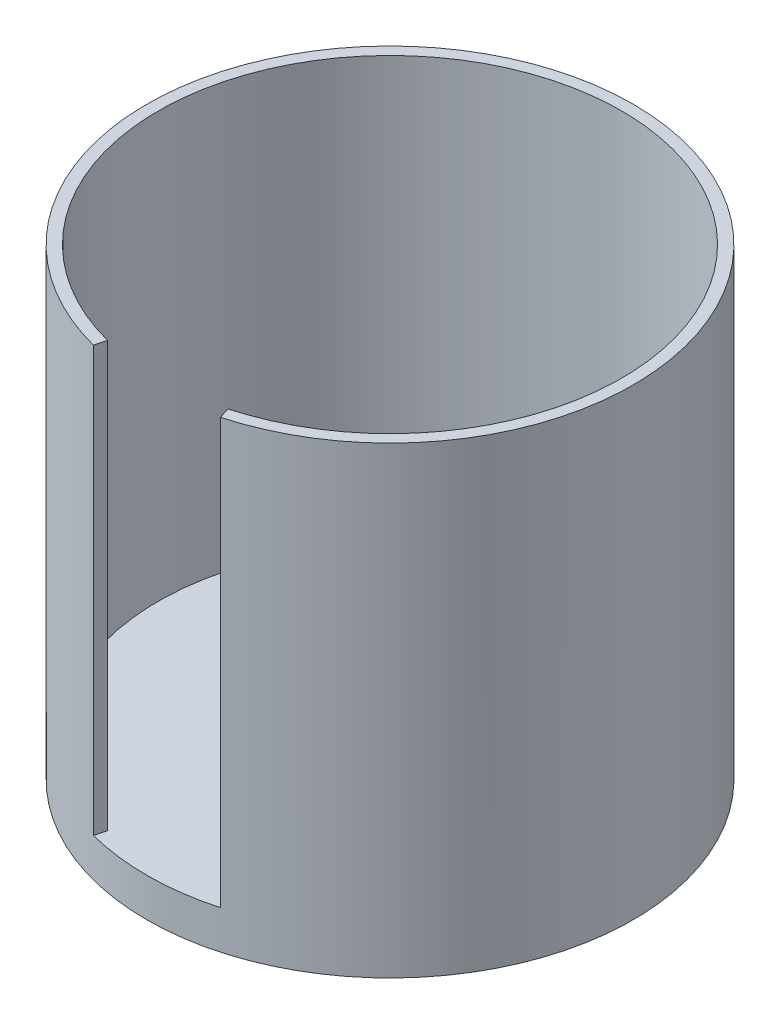
from build123d import *

# Parameters (mm, degrees)
ESQUISSE1_W             = 31.5
ESQUISSE1_H             = 60
ENL_V_START             = -55
ESQUISSE2_R             = 30
ENL_V_MAT_EXTRU_4_DEPTH = 55
ENL_V_MAT_EXTRU_7_DEPTH = 4


with BuildPart() as part:
    # Esquisse1 → Révolution1 (revolve)
    with BuildSketch(Plane.XY, mode=Mode.PRIVATE) as r_volution1_sk:
        with Locations((15.75, 30)):
            Rectangle(ESQUISSE1_W, ESQUISSE1_H)
    revolve(r_volution1_sk.sketch.rotate(Axis((0, 0, 0), (0, 1, 0)), 90), axis=Axis((0, 0, 0), (0, 1, 0)))

    # Esquisse2 → Enlèv. mat.-Extru.4 (cut)
    with BuildSketch(Plane(origin=(0, 60, 0), x_dir=(1, 0, 0), z_dir=(0, 1, 0)).offset(ENL_V_START)):
        Circle(ESQUISSE2_R)
        with BuildLine():
            Line((-7.923821592, -30.487096473), (0, 0))
            Line((0, 0), (8.381317443, -30.36451083))
            ThreePointArc((8.381317443, -30.36451083), (0.236817278, -31.49910979), (-7.923821592, -30.487096473))
        make_face()
    extrude(amount=ENL_V_MAT_EXTRU_4_DEPTH, mode=Mode.SUBTRACT)

    # Esquisse4 → Enlèv. mat.-Extru.7 (cut)
    with BuildSketch(Plane(origin=(0, 0, 0), x_dir=(-1, 0, 0), z_dir=(0, -1, 0))):
        with BuildLine():
            Line((-1, 1.118033989), (-1, -1.118033989))
            ThreePointArc((-1, -1.118033989), (0.612372436, -1.369306394), (1.5, 0))
            ThreePointArc((1.5, 0), (0.612372436, 1.369306394), (-1, 1.118033989))
        make_face()
    extrude(amount=-ENL_V_MAT_EXTRU_7_DEPTH, mode=Mode.SUBTRACT)


solid = part.part
